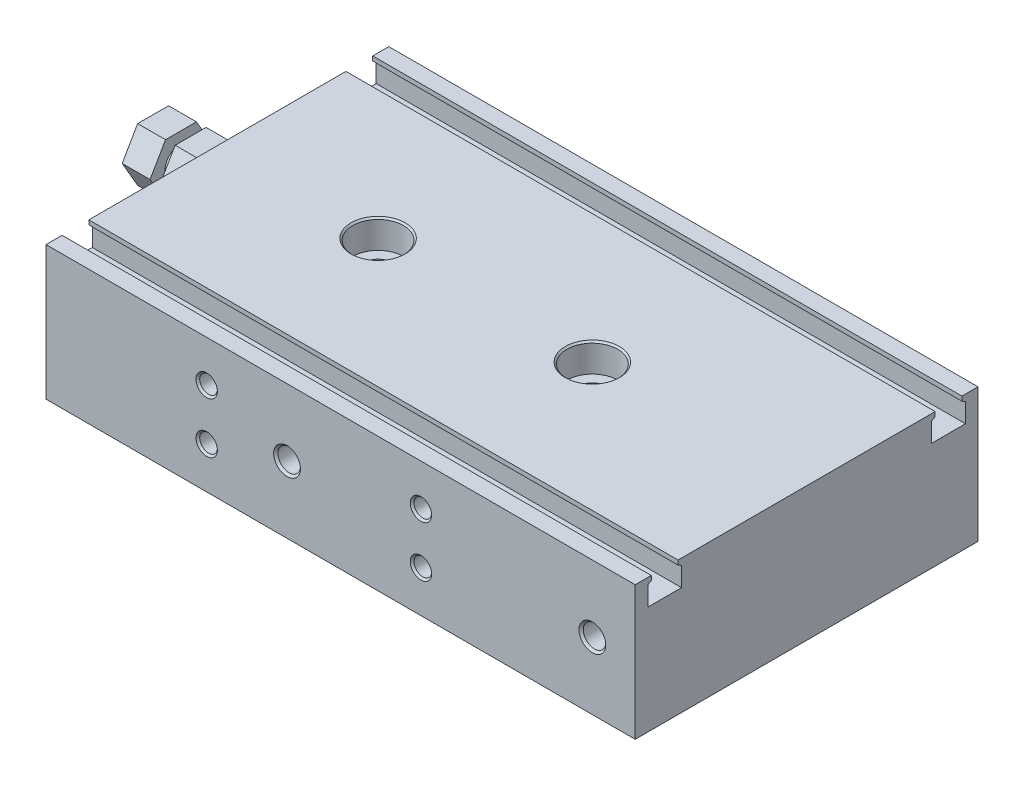
from build123d import *

# Parameters (mm, degrees)
BODY_SKETCH_W                                = 64
BODY_SKETCH_H                                = 25
BODY_DEPTH                                   = 110
BODY_ROD_HOLES_SKETCH_R                      = 5
BODY_ROD_HOLES_DEPTH                         = 10
BODY_PISTON_HOLES_SKETCH_R                   = 6.05
BODY_PISTON_HOLES_DEPTH                      = 41
TOP_SWITCH_GROOVES_DEPTH                     = 116.239967025
SHCS_MGT_HOLE_CHAM_SIZE                      = 0.3
SHCS_MGT_HOLE_PAT_COUNT                      = 2
SHCS_MGT_HOLE_PAT_PITCH                      = 40
SHCS_MGT_HOLE_CHAM_OF_SHCS_MGT_HOLE_PAT_SIZE = 0.3
SHCS_MGT_HOLE_BOT_TAP_AT_2_COUNT             = 2
SHCS_MGT_HOLE_BOT_TAP_AT_2_PITCH             = 40
ADJUSTER_NUT_DEPTH                           = 12
ADJUSTER_NUT_THREADS_SKETCH_W                = 1.8
ADJUSTER_NUT_THREADS_SKETCH_H                = 25
TAP_DRILL_FOR_M5X0_8_TAP1_D                  = 4.2
TAP_DRILL_FOR_M5X0_8_TAP1_DEPTH              = 4.5
TAP_DRILL_FOR_M5X0_8_TAP1_CSINK_D            = 5
TAP_DRILL_FOR_M5X0_8_TAP1_CSINK_ANGLE        = 90
TAP_DRILL_FOR_M5X0_8_TAP1_TIP                = 1.2618073
TAP_DRILL_FOR_M5X0_8_TAP2_D                  = 4.2
TAP_DRILL_FOR_M5X0_8_TAP2_DEPTH              = 4.5
TAP_DRILL_FOR_M5X0_8_TAP2_CSINK_D            = 5
TAP_DRILL_FOR_M5X0_8_TAP2_CSINK_ANGLE        = 90
TAP_DRILL_FOR_M5X0_8_TAP2_TIP                = 1.2618073
MOUNT_HOLES_1_D                              = 3.3
MOUNT_HOLES_1_DEPTH                          = 5.5
MOUNT_HOLES_1_CSINK_D                        = 4
MOUNT_HOLES_1_CSINK_ANGLE                    = 90
MOUNT_HOLES_1_TIP                            = 0.991420021
MOUNT_HOLES_2_D                              = 3.3
MOUNT_HOLES_2_DEPTH                          = 5.5
MOUNT_HOLES_2_CSINK_D                        = 4
MOUNT_HOLES_2_CSINK_ANGLE                    = 90
MOUNT_HOLES_2_TIP                            = 0.991420021
MOUNT_HOLES_3_D                              = 3.3
MOUNT_HOLES_3_DEPTH                          = 5.5
MOUNT_HOLES_3_CSINK_D                        = 4
MOUNT_HOLES_3_CSINK_ANGLE                    = 90
MOUNT_HOLES_3_TIP                            = 0.991420021
MOUNT_HOLES_4_D                              = 3.3
MOUNT_HOLES_4_DEPTH                          = 5.5
MOUNT_HOLES_4_CSINK_D                        = 4
MOUNT_HOLES_4_CSINK_ANGLE                    = 90
MOUNT_HOLES_4_TIP                            = 0.991420021


with BuildPart() as part:
    # Body_Sketch → Body (new body)
    with BuildSketch(Plane(origin=(0, 0, 0), x_dir=(0, 0, -1), z_dir=(1, 0, 0))):
        Rectangle(BODY_SKETCH_W, BODY_SKETCH_H)
    extrude(amount=BODY_DEPTH)

    # Body Rod Holes_Sketch → Body Rod Holes (cut)
    with BuildSketch(Plane.ZY):
        with Locations((-14, 0)):
            Circle(BODY_ROD_HOLES_SKETCH_R)
        with Locations(Location((14, 0, 0), (0, 0, 180))):
            Circle(BODY_ROD_HOLES_SKETCH_R)
    extrude(amount=-BODY_ROD_HOLES_DEPTH, mode=Mode.SUBTRACT)

    # Body Piston Holes_Sketch → Body Piston Holes (cut)
    with BuildSketch(Plane.ZY.offset(-10)):
        with Locations((14, 0)):
            Circle(BODY_PISTON_HOLES_SKETCH_R)
        with Locations((-14, 0)):
            Circle(BODY_PISTON_HOLES_SKETCH_R)
    extrude(amount=-BODY_PISTON_HOLES_DEPTH, mode=Mode.SUBTRACT)

    # Top Switch Grooves_Sketch → Top Switch Grooves (cut, through all)
    with BuildSketch(Plane.ZY):
        Polygon((23.35, 7.7), (29.65, 7.7), (29.65, 11.3), (29, 11.675277675), (29, 12.5), (24, 12.5), (24, 11.675277675), (23.35, 11.3), align=None)
        Polygon((-23.35, 11.3), (-23.35, 7.7), (-29.65, 7.7), (-29.65, 11.3), (-29, 11.675277675), (-29, 12.5), (-24, 12.5), (-24, 11.675277675), align=None)
    extrude(amount=-TOP_SWITCH_GROOVES_DEPTH, mode=Mode.SUBTRACT)

    # SHCS MGT Hole_Sketch → SHCS MGT Hole (revolve, cut)
    with BuildSketch(Plane.XY, mode=Mode.PRIVATE) as shcs_mgt_hole_sk:
        Polygon((30, 12.5), (25.25, 12.5), (25.25, 7.2), (27.25, 7.2), (27.25, -12.5), (30, -12.5), align=None)
    shcs_mgt_hole = revolve(shcs_mgt_hole_sk.sketch.rotate(Axis((30, -11.506886035, 0), (0, 1, 0)), 270), axis=Axis((30, -11.506886035, 0), (0, 1, 0)), mode=Mode.SUBTRACT)

    # SHCS MGT Hole Cham
    shcs_mgt_hole_cham_edges = [part.edges().sort_by_distance(p)[0] for p in [
        (30, 12.5, 4.75),
    ]]
    chamfer(shcs_mgt_hole_cham_edges, length=SHCS_MGT_HOLE_CHAM_SIZE)

    # SHCS MGT Hole Pat: SHCS MGT Hole ×2
    with Locations(*[(i * SHCS_MGT_HOLE_PAT_PITCH, 0, 0) for i in range(1, SHCS_MGT_HOLE_PAT_COUNT)]):
        add(shcs_mgt_hole, mode=Mode.SUBTRACT)

    # SHCS MGT Hole Cham of SHCS MGT Hole Pat
    shcs_mgt_hole_cham_of_shcs_mgt_hole_pat_edges = [part.edges().sort_by_distance(p)[0] for p in [
        (70, 12.5, 4.75),
    ]]
    chamfer(shcs_mgt_hole_cham_of_shcs_mgt_hole_pat_edges, length=SHCS_MGT_HOLE_CHAM_OF_SHCS_MGT_HOLE_PAT_SIZE)

    # SHCS MGT Hole Bot Tap Profile → SHCS MGT Hole Bot Tap (revolve, cut)
    with BuildSketch(Plane(origin=(30, -12.5, 0), x_dir=(0, 0, -1), z_dir=(1, 0, 0))):
        Polygon((0, 0), (0, 12.652366702), (2.75, 11), (2.75, 10), (3, 10), (3, 0.3), (3.3, 0), align=None)
    shcs_mgt_hole_bot_tap = revolve(axis=Axis((30, -18.85, 0), (0, 1, 0)), mode=Mode.SUBTRACT)

    # SHCS MGT Hole Bot Tap at 2: SHCS MGT Hole Bot Tap ×2
    with Locations(*[(i * SHCS_MGT_HOLE_BOT_TAP_AT_2_PITCH, 0, 0) for i in range(1, SHCS_MGT_HOLE_BOT_TAP_AT_2_COUNT)]):
        add(shcs_mgt_hole_bot_tap, mode=Mode.SUBTRACT)

    # Adjuster Nut_Sketch → Adjuster Nut (add)
    with BuildSketch(Plane.ZY):
        Polygon((-2.886751346, 11.5), (2.886751346, 11.5), (5.773502692, 6.5), (2.886751346, 1.5), (-2.886751346, 1.5), (-5.773502692, 6.5), align=None)
    extrude(amount=ADJUSTER_NUT_DEPTH)

    # Adjuster Nut Threads_Sketch → Adjuster Nut Threads (revolve, cut)
    with BuildSketch(Plane.XY, mode=Mode.PRIVATE) as adjuster_nut_threads_sk:
        with Locations((-5.9, 22)):
            Rectangle(ADJUSTER_NUT_THREADS_SKETCH_W, ADJUSTER_NUT_THREADS_SKETCH_H)
    revolve(adjuster_nut_threads_sk.sketch.rotate(Axis((-6.476, 6.5, 0), (1, 0, 0)), 270), axis=Axis((-6.476, 6.5, 0), (1, 0, 0)), mode=Mode.SUBTRACT)

    # Tap Drill for M5x0.8 Tap1
    with Locations(Plane.XY.offset(32)):
        with Locations((45, 0), (102, 0)):
            CounterSinkHole(TAP_DRILL_FOR_M5X0_8_TAP1_D / 2, TAP_DRILL_FOR_M5X0_8_TAP1_CSINK_D / 2, depth=TAP_DRILL_FOR_M5X0_8_TAP1_DEPTH, counter_sink_angle=TAP_DRILL_FOR_M5X0_8_TAP1_CSINK_ANGLE)
            with Locations((0, 0, -(TAP_DRILL_FOR_M5X0_8_TAP1_DEPTH + TAP_DRILL_FOR_M5X0_8_TAP1_TIP / 2))):  # 118° drill point
                Cone(0, TAP_DRILL_FOR_M5X0_8_TAP1_D / 2, TAP_DRILL_FOR_M5X0_8_TAP1_TIP, mode=Mode.SUBTRACT)

    # Tap Drill for M5x0.8 Tap2
    with Locations(Plane(origin=(0, 0, -32), x_dir=(-1, 0, 0), z_dir=(0, 0, -1))):
        with Locations((-102, 0), (-45, 0)):
            CounterSinkHole(TAP_DRILL_FOR_M5X0_8_TAP2_D / 2, TAP_DRILL_FOR_M5X0_8_TAP2_CSINK_D / 2, depth=TAP_DRILL_FOR_M5X0_8_TAP2_DEPTH, counter_sink_angle=TAP_DRILL_FOR_M5X0_8_TAP2_CSINK_ANGLE)
            with Locations((0, 0, -(TAP_DRILL_FOR_M5X0_8_TAP2_DEPTH + TAP_DRILL_FOR_M5X0_8_TAP2_TIP / 2))):  # 118° drill point
                Cone(0, TAP_DRILL_FOR_M5X0_8_TAP2_D / 2, TAP_DRILL_FOR_M5X0_8_TAP2_TIP, mode=Mode.SUBTRACT)

    # Mount_Holes_1
    with Locations(Plane.XY.offset(32)):
        with Locations((30, -4.75), (70, -4.75)):
            CounterSinkHole(MOUNT_HOLES_1_D / 2, MOUNT_HOLES_1_CSINK_D / 2, depth=MOUNT_HOLES_1_DEPTH, counter_sink_angle=MOUNT_HOLES_1_CSINK_ANGLE)
            with Locations((0, 0, -(MOUNT_HOLES_1_DEPTH + MOUNT_HOLES_1_TIP / 2))):  # 118° drill point
                Cone(0, MOUNT_HOLES_1_D / 2, MOUNT_HOLES_1_TIP, mode=Mode.SUBTRACT)

    # Mount_Holes_2
    with Locations(Plane(origin=(0, 0, -32), x_dir=(-1, 0, 0), z_dir=(0, 0, -1))):
        with Locations((-70, -4.75), (-30, -4.75)):
            CounterSinkHole(MOUNT_HOLES_2_D / 2, MOUNT_HOLES_2_CSINK_D / 2, depth=MOUNT_HOLES_2_DEPTH, counter_sink_angle=MOUNT_HOLES_2_CSINK_ANGLE)
            with Locations((0, 0, -(MOUNT_HOLES_2_DEPTH + MOUNT_HOLES_2_TIP / 2))):  # 118° drill point
                Cone(0, MOUNT_HOLES_2_D / 2, MOUNT_HOLES_2_TIP, mode=Mode.SUBTRACT)

    # Mount_Holes_3
    with Locations(Plane.XY.offset(32)):
        with Locations((30, 4.75), (70, 4.75)):
            CounterSinkHole(MOUNT_HOLES_3_D / 2, MOUNT_HOLES_3_CSINK_D / 2, depth=MOUNT_HOLES_3_DEPTH, counter_sink_angle=MOUNT_HOLES_3_CSINK_ANGLE)
            with Locations((0, 0, -(MOUNT_HOLES_3_DEPTH + MOUNT_HOLES_3_TIP / 2))):  # 118° drill point
                Cone(0, MOUNT_HOLES_3_D / 2, MOUNT_HOLES_3_TIP, mode=Mode.SUBTRACT)

    # Mount_Holes_4
    with Locations(Plane(origin=(0, 0, -32), x_dir=(-1, 0, 0), z_dir=(0, 0, -1))):
        with Locations((-70, 4.75), (-30, 4.75)):
            CounterSinkHole(MOUNT_HOLES_4_D / 2, MOUNT_HOLES_4_CSINK_D / 2, depth=MOUNT_HOLES_4_DEPTH, counter_sink_angle=MOUNT_HOLES_4_CSINK_ANGLE)
            with Locations((0, 0, -(MOUNT_HOLES_4_DEPTH + MOUNT_HOLES_4_TIP / 2))):  # 118° drill point
                Cone(0, MOUNT_HOLES_4_D / 2, MOUNT_HOLES_4_TIP, mode=Mode.SUBTRACT)


solid = part.part
